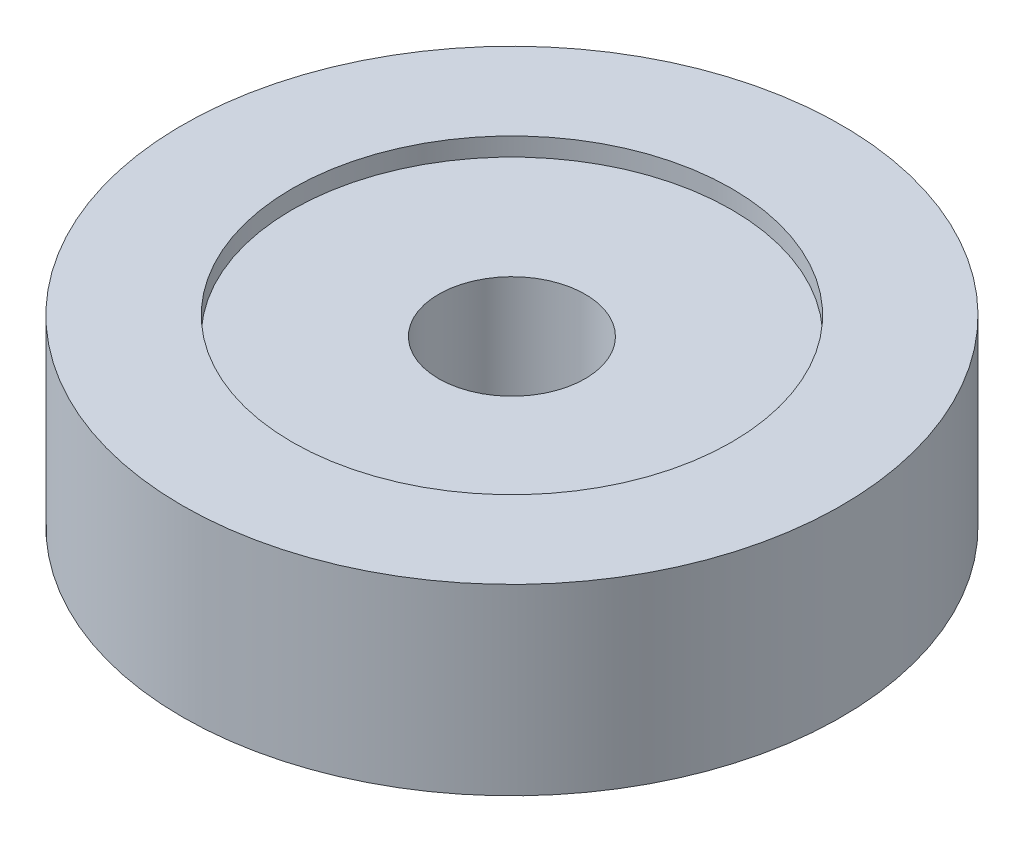
from build123d import *

# Parameters (mm, degrees)
SKETCH_1_R      = 6
SKETCH_1_R_2    = 2
EXTRUDE_1_DEPTH = 2
SKETCH_2_R      = 9
SKETCH_2_R_2    = 6
EXTRUDE_2_DEPTH = 2.5


with BuildPart() as part:
    # 草图1 → 凸台-拉伸1 (new, symmetric)
    with BuildSketch(Plane(origin=(0, 0, 0), x_dir=(1, 0, 0), z_dir=(0, 1, 0))):
        with Locations(Location((0, 0, 0), (0, 0, 270))):
            Circle(SKETCH_1_R)
        with Locations(Location((0, 0, 0), (0, 0, 270))):
            Circle(SKETCH_1_R_2, mode=Mode.SUBTRACT)
    extrude(amount=EXTRUDE_1_DEPTH, both=True)


with BuildPart() as body_2:
    # 草图2 → 凸台-拉伸2 (new, symmetric)
    with BuildSketch(Plane(origin=(0, 0, 0), x_dir=(1, 0, 0), z_dir=(0, 1, 0))):
        with Locations(Location((0, 0, 0), (0, 0, 270))):
            Circle(SKETCH_2_R)
        with Locations(Location((0, 0, 0), (0, 0, 270))):
            Circle(SKETCH_2_R_2, mode=Mode.SUBTRACT)
    extrude(amount=EXTRUDE_2_DEPTH, both=True)


solid = Compound([part.part, body_2.part])
